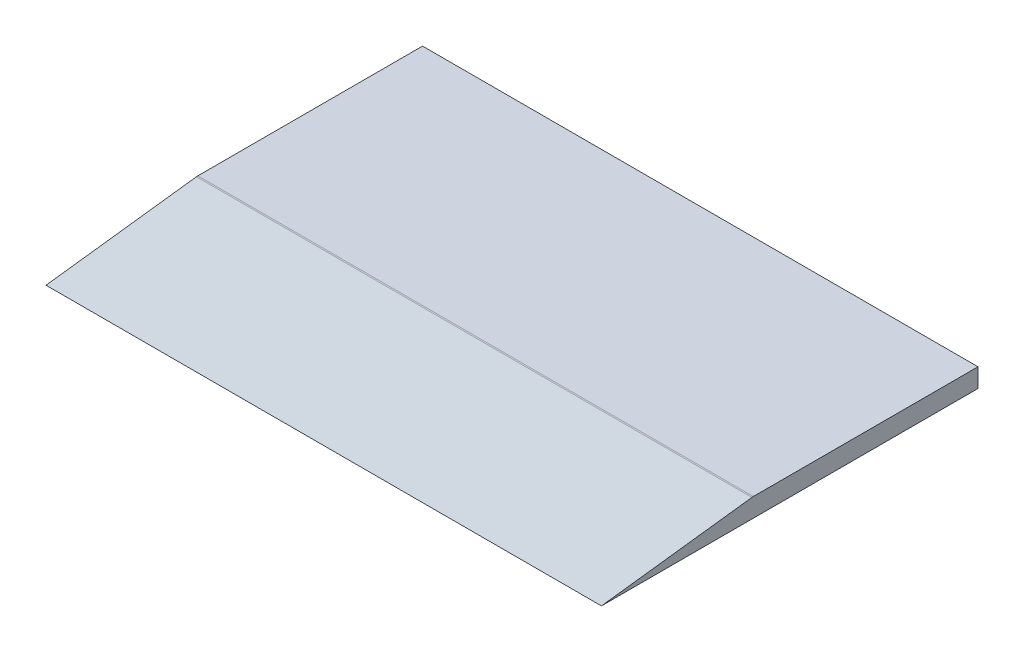
from build123d import *

# Parameters (mm, degrees)
SKETCH2_W           = 374.6754
SKETCH2_H           = 254
BOSS_EXTRUDE2_DEPTH = 12.7
CUT_EXTRUDE1_DEPTH  = 453.834346495
FILLET1_R           = 7.62


with BuildPart() as part:
    # Sketch2 → Boss-Extrude2 (new body)
    with BuildSketch(Plane(origin=(0, 0, 0), x_dir=(1, 0, 0), z_dir=(0, 1, 0))):
        with Locations((187.3377, 127)):
            Rectangle(SKETCH2_W, SKETCH2_H)
    extrude(amount=BOSS_EXTRUDE2_DEPTH)

    # Sketch4 → Cut-Extrude1 (cut, through all)
    with BuildSketch(Plane(origin=(374.6754, 0, 0), x_dir=(0, 0, -1), z_dir=(1, 0, 0))):
        Polygon((101.961691264, 12.7), (0, 0), (0, 12.7), align=None)
    extrude(amount=-CUT_EXTRUDE1_DEPTH, mode=Mode.SUBTRACT)

    # Fillet1
    fillet1_edges = [part.edges().sort_by_distance(p)[0] for p in [
        (187.3377, 12.7, -101.961691264),
    ]]
    fillet(fillet1_edges, radius=FILLET1_R)


solid = part.part
